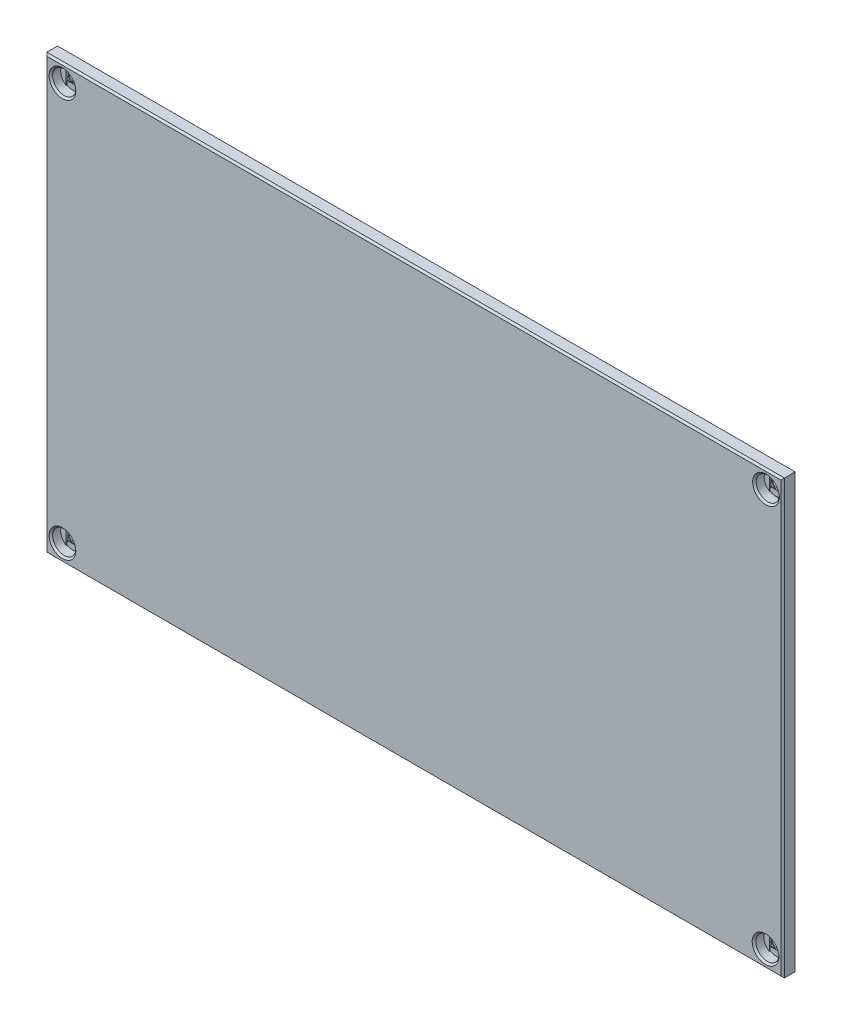
from build123d import *
from build123d.topology import SkipClean

# Parameters (mm, degrees)
SKETCH2_W               = 165.75
SKETCH2_H               = 97.3
SKETCH2_R               = 1.35
BOSS_EXTRUDE1_DEPTH     = 2.8
SKETCH3_R               = 2.6
CUT_EXTRUDE1_DEPTH      = 2.2
CUT_EXTRUDE2_DEPTH      = 0.2
SKETCH5_W               = 2.7
SKETCH5_H               = 2.7
CUT_EXTRUDE3_DEPTH      = 0.2
MIRROR2_COPY_1_DEPTH    = 0.2
MIRROR2_COPY_2_SKETCH_W = 2.7
MIRROR2_COPY_2_SKETCH_H = 2.7
MIRROR2_COPY_2_DEPTH    = 0.2
CHAMFER1_SIZE           = 0.4


with BuildPart() as part:
    # Sketch2 → Boss-Extrude1 (new body)
    with BuildSketch(Plane.XY):
        with Locations((-0.025, -59.25)):
            Rectangle(SKETCH2_W, SKETCH2_H)
        with Locations((-79, -14.5)):
            Circle(SKETCH2_R, mode=Mode.SUBTRACT)
        with Locations((79.1, -14.5)):
            Circle(SKETCH2_R, mode=Mode.SUBTRACT)
        with Locations((79, -104)):
            Circle(SKETCH2_R, mode=Mode.SUBTRACT)
        with Locations((-79, -104)):
            Circle(SKETCH2_R, mode=Mode.SUBTRACT)
    extrude(amount=BOSS_EXTRUDE1_DEPTH)

    # Sketch3 → Cut-Extrude1 (cut)
    with BuildSketch(Plane.XY.offset(2.8)):
        with Locations((-79, -14.5)):
            Circle(SKETCH3_R)
        with Locations((-79, -104)):
            Circle(SKETCH3_R)
        with Locations((79, -104)):
            Circle(SKETCH3_R)
        with Locations((79.1, -14.5)):
            Circle(SKETCH3_R)
    extrude(amount=-CUT_EXTRUDE1_DEPTH, mode=Mode.SUBTRACT)

    # Sketch4 → Cut-Extrude2 (cut)
    with SkipClean():  # the faces are left unmerged after this step: merging them gives an invalid solid
        with BuildSketch(Plane.XY.offset(0.6)):
            with BuildLine():
                Line((-80.35, -16.722048604), (-80.35, -12.277951396))
                ThreePointArc((-80.35, -12.277951396), (-79, -11.9), (-77.65, -12.277951396))
                Line((-77.65, -12.277951396), (-77.65, -16.722048604))
                ThreePointArc((-77.65, -16.722048604), (-79, -17.1), (-80.35, -16.722048604))
            make_face()
        cut_extrude2 = extrude(amount=-CUT_EXTRUDE2_DEPTH, mode=Mode.SUBTRACT)

    # Sketch5 → Cut-Extrude3 (cut)
    with SkipClean():  # the faces are left unmerged after this step: merging them gives an invalid solid
        with BuildSketch(Plane.XY.offset(0.4)):
            with Locations((-79, -14.5)):
                Rectangle(SKETCH5_W, SKETCH5_H)
        cut_extrude3 = extrude(amount=-CUT_EXTRUDE3_DEPTH, mode=Mode.SUBTRACT)

    # Mirror1: Cut-Extrude2, Cut-Extrude3 across plane
    with SkipClean():  # the faces are left unmerged after this step: merging them gives an invalid solid
        add(cut_extrude2.mirror(Plane.ZX.offset(-59.25)), mode=Mode.SUBTRACT)
        add(cut_extrude3.mirror(Plane.ZX.offset(-59.25)), mode=Mode.SUBTRACT)

    # Mirror2: Cut-Extrude2, Cut-Extrude3 across plane
    with SkipClean():  # the faces are left unmerged after this step: merging them gives an invalid solid
        add(cut_extrude2.mirror(Plane(origin=(0, 0, 0), x_dir=(0, 0, 1), z_dir=(1, 0, 0))), mode=Mode.SUBTRACT)
        add(cut_extrude3.mirror(Plane(origin=(0, 0, 0), x_dir=(0, 0, 1), z_dir=(1, 0, 0))), mode=Mode.SUBTRACT)

    # Mirror2 copy 1 sketch → Mirror2 copy 1 (cut)
    with SkipClean():  # the faces are left unmerged after this step: merging them gives an invalid solid
        with BuildSketch(Plane(origin=(0, -118.5, 0.6), x_dir=(-1, 0, 0), z_dir=(0, 0, 1))):
            with BuildLine():
                Line((-80.35, -16.722048604), (-80.35, -12.277951396))
                ThreePointArc((-80.35, -12.277951396), (-79, -11.9), (-77.65, -12.277951396))
                Line((-77.65, -12.277951396), (-77.65, -16.722048604))
                ThreePointArc((-77.65, -16.722048604), (-79, -17.1), (-80.35, -16.722048604))
            make_face()
        extrude(amount=-MIRROR2_COPY_1_DEPTH, mode=Mode.SUBTRACT)

    # Mirror2 copy 2 sketch → Mirror2 copy 2 (cut)
    with SkipClean():  # the faces are left unmerged after this step: merging them gives an invalid solid
        with BuildSketch(Plane(origin=(0, -118.5, 0.4), x_dir=(-1, 0, 0), z_dir=(0, 0, 1))):
            with Locations((-79, -14.5)):
                Rectangle(MIRROR2_COPY_2_SKETCH_W, MIRROR2_COPY_2_SKETCH_H)
        extrude(amount=-MIRROR2_COPY_2_DEPTH, mode=Mode.SUBTRACT)

    # Chamfer1
    chamfer1_edges = [part.edges().sort_by_distance(p)[0] for p in [
        (82.85, -59.25, 2.8),
        (-0.025, -10.6, 2.8),
        (76.5, -14.5, 2.8),
        (76.4, -104, 2.8),
        (-81.6, -104, 2.8),
        (-81.6, -14.5, 2.8),
        (-82.9, -59.25, 2.8),
        (-0.025, -107.9, 2.8),
    ]]
    chamfer(chamfer1_edges, length=CHAMFER1_SIZE)


solid = part.part
